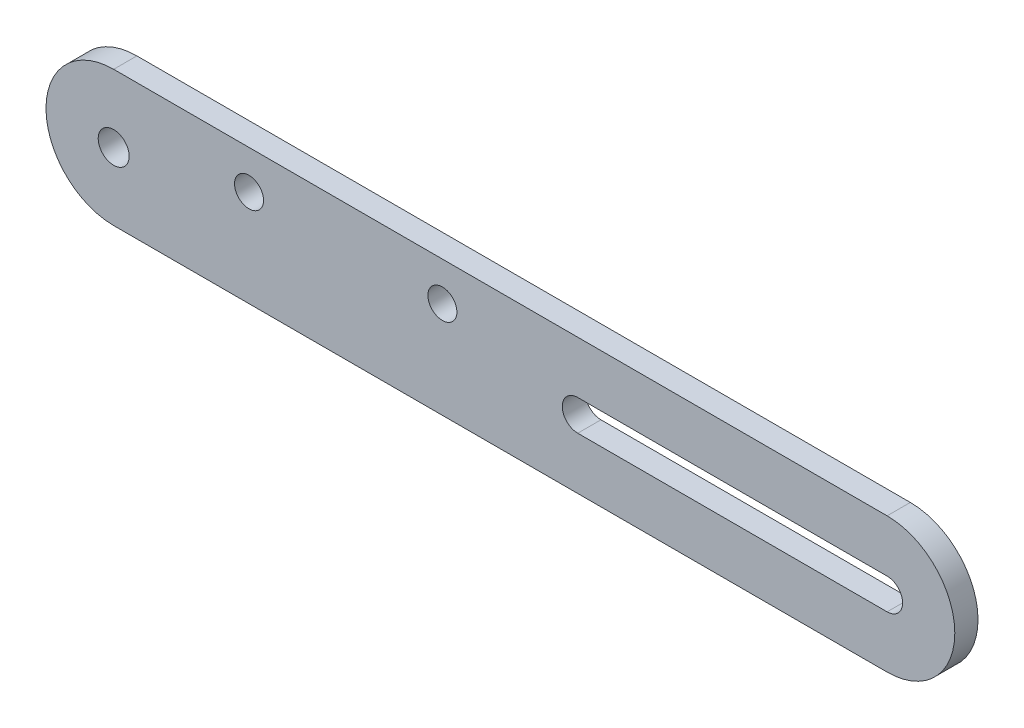
from build123d import *

# Parameters (mm, degrees)
ESQUISSE1_R             = 4
BOSS_EXTRU_1_DEPTH      = 6
ENL_V_MAT_EXTRU_1_REACH = 132.108
ESQUISSE2_R             = 3.75


with BuildPart() as part:
    # Esquisse1 → Boss.-Extru.1 (new body)
    with BuildSketch(Plane.XY):
        with BuildLine():
            Line((-111.286517575, 17.5), (88.713482425, 17.5))
            ThreePointArc((88.713482425, 17.5), (106.213482425, 0), (88.713482425, -17.5))
            Line((88.713482425, -17.5), (-111.286517575, -17.5))
            ThreePointArc((-111.286517575, -17.5), (-128.786517575, 0), (-111.286517575, 17.5))
        make_face()
        with Locations((-111.286517575, 0)):
            Circle(ESQUISSE1_R, mode=Mode.SUBTRACT)
        with BuildLine():
            Line((88.713482425, -4), (8.713482425, -4))
            ThreePointArc((8.713482425, -4), (4.713482425, 0), (8.713482425, 4))
            Line((8.713482425, 4), (88.713482425, 4))
            ThreePointArc((88.713482425, 4), (92.713482425, 0), (88.713482425, -4))
        make_face(mode=Mode.SUBTRACT)
    extrude(amount=BOSS_EXTRU_1_DEPTH)

    # Esquisse2 → Enlèv. mat.-Extru.1 (cut, up to next)
    with BuildSketch(Plane.XY.offset(6), mode=Mode.PRIVATE) as enl_v_mat_extru_1_sk1:
        with Locations((-76.286517575, 7.5)):
            Circle(ESQUISSE2_R)
    enl_v_mat_extru_1_tool1 = extrude(enl_v_mat_extru_1_sk1.sketch, amount=-ENL_V_MAT_EXTRU_1_REACH, mode=Mode.PRIVATE) & part.part
    # Esquisse2 → Enlèv. mat.-Extru.1 (cut, up to next)
    with BuildSketch(Plane.XY.offset(6), mode=Mode.PRIVATE) as enl_v_mat_extru_1_sk2:
        with Locations((-26.286517575, 7.5)):
            Circle(ESQUISSE2_R)
    enl_v_mat_extru_1_tool2 = extrude(enl_v_mat_extru_1_sk2.sketch, amount=-ENL_V_MAT_EXTRU_1_REACH, mode=Mode.PRIVATE) & part.part
    add(enl_v_mat_extru_1_tool1.solids().sort_by_distance((-76.286518, 7.5, 6))[0], mode=Mode.SUBTRACT)
    add(enl_v_mat_extru_1_tool2.solids().sort_by_distance((-26.286518, 7.5, 6))[0], mode=Mode.SUBTRACT)


solid = part.part
